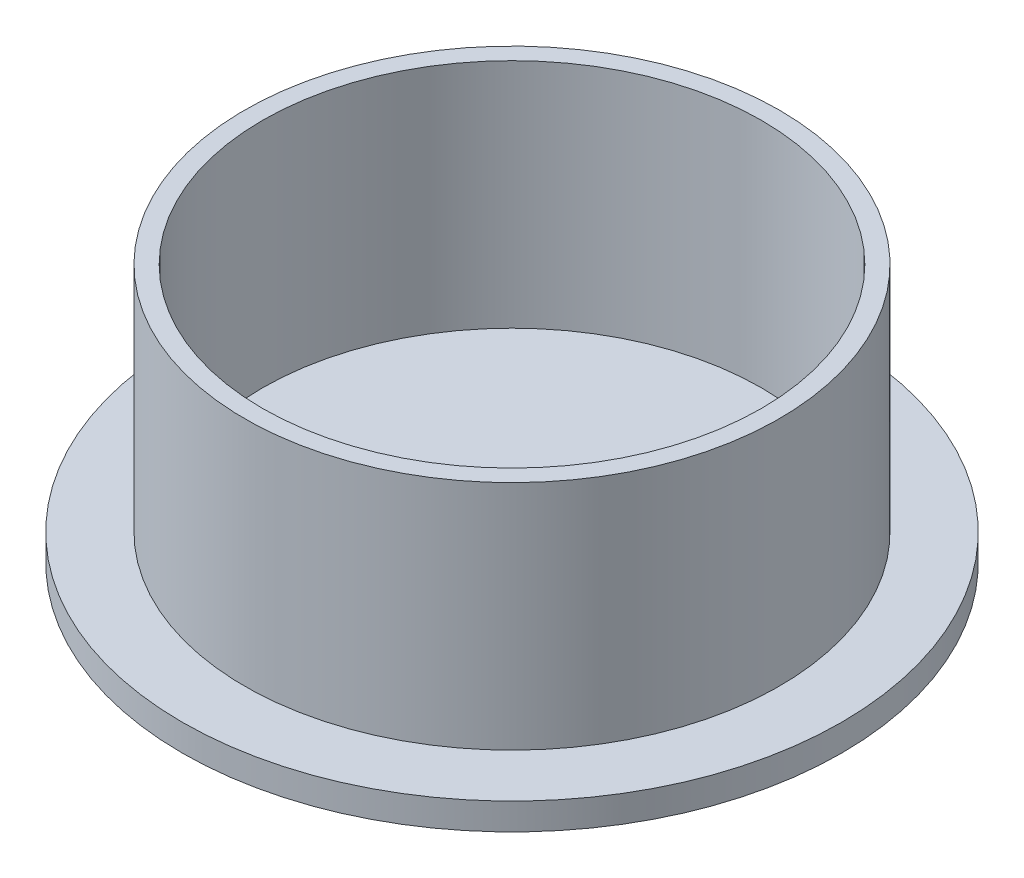
from build123d import *

# Parameters (mm, degrees)
SKETCH1_R           = 37
BOSS_EXTRUDE1_DEPTH = 3
SKETCH1_3_R         = 30
SKETCH1_3_R_2       = 28
BOSS_EXTRUDE2_DEPTH = 29
SKETCH2_R           = 4
SKETCH2_R_2         = 2
CUT_EXTRUDE1_DEPTH  = 59.429444632


with BuildPart() as part:
    # Sketch1 → Boss-Extrude1 (new body)
    with BuildSketch(Plane(origin=(0, 0, 0), x_dir=(1, 0, 0), z_dir=(0, 1, 0))):
        Circle(SKETCH1_R)
    extrude(amount=BOSS_EXTRUDE1_DEPTH)

    # Sketch1<3> → Boss-Extrude2 (add)
    with BuildSketch(Plane(origin=(0, 0, 0), x_dir=(1, 0, 0), z_dir=(0, 1, 0))):
        Circle(SKETCH1_3_R)
        Circle(SKETCH1_3_R_2, mode=Mode.SUBTRACT)
    extrude(amount=BOSS_EXTRUDE2_DEPTH)

    # Sketch2 → Cut-Extrude1 (cut, through all)
    with BuildSketch(Plane(origin=(0, 3, 0), x_dir=(1, 0, 0), z_dir=(0, 1, 0))):
        Circle(SKETCH2_R)
        with Locations((8, 0)):
            Circle(SKETCH2_R_2)
        with Locations((0, -8)):
            Circle(SKETCH2_R_2)
        with Locations((-8, 0)):
            Circle(SKETCH2_R_2)
        with Locations((0, 8)):
            Circle(SKETCH2_R_2)
    extrude(amount=-CUT_EXTRUDE1_DEPTH, mode=Mode.SUBTRACT)


solid = part.part
